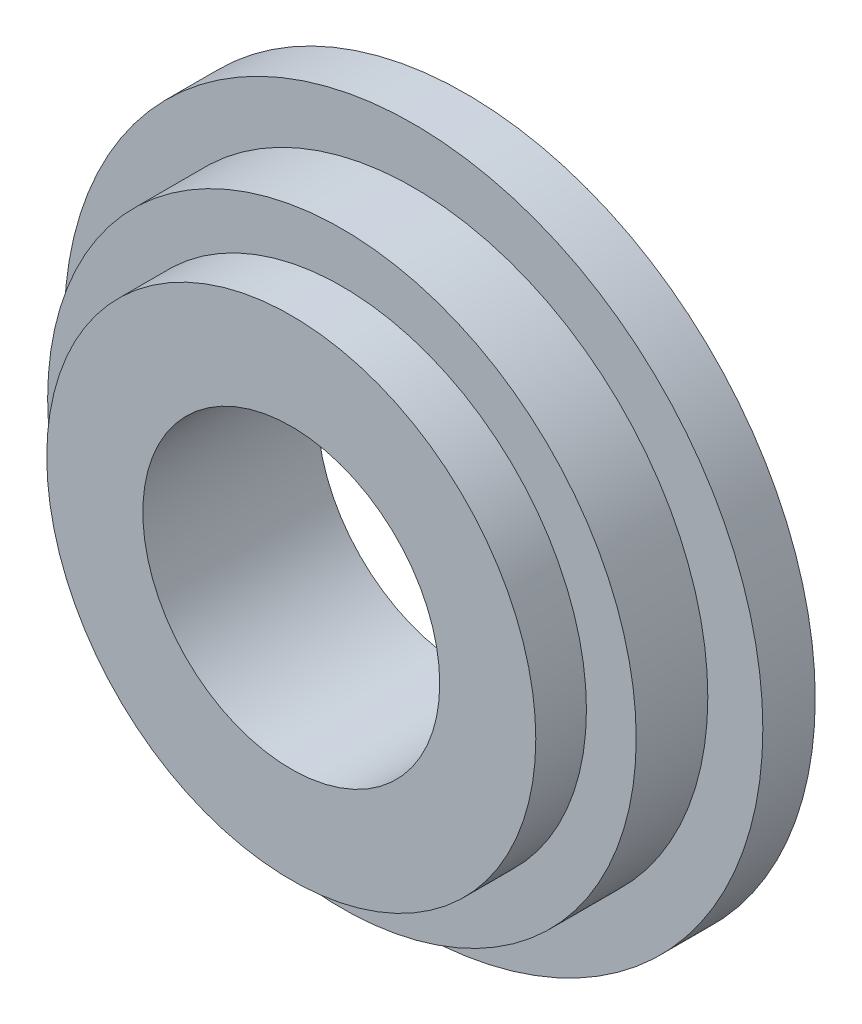
from build123d import *

# Parameters (mm, degrees)
SKETCH_1_R      = 20
SKETCH_1_R_2    = 16.85
EXTRUDE_1_DEPTH = 3
SKETCH_1_3_R    = 16.85
SKETCH_1_3_R_2  = 14
EXTRUDE_2_DEPTH = 7.1
SKETCH_1_4_R    = 14
SKETCH_1_4_R_2  = 8.5
EXTRUDE_3_DEPTH = 10


with BuildPart() as part:
    # 草图1 → 凸台-拉伸1 (new body)
    with BuildSketch(Plane.XY):
        Circle(SKETCH_1_R)
        Circle(SKETCH_1_R_2, mode=Mode.SUBTRACT)
    extrude(amount=EXTRUDE_1_DEPTH)

    # 草图1<3> → 凸台-拉伸2 (add)
    with BuildSketch(Plane.XY):
        Circle(SKETCH_1_3_R)
        Circle(SKETCH_1_3_R_2, mode=Mode.SUBTRACT)
    extrude(amount=EXTRUDE_2_DEPTH)

    # 草图1<4> → 凸台-拉伸3 (add)
    with BuildSketch(Plane.XY):
        Circle(SKETCH_1_4_R)
        Circle(SKETCH_1_4_R_2, mode=Mode.SUBTRACT)
    extrude(amount=EXTRUDE_3_DEPTH)


solid = part.part
